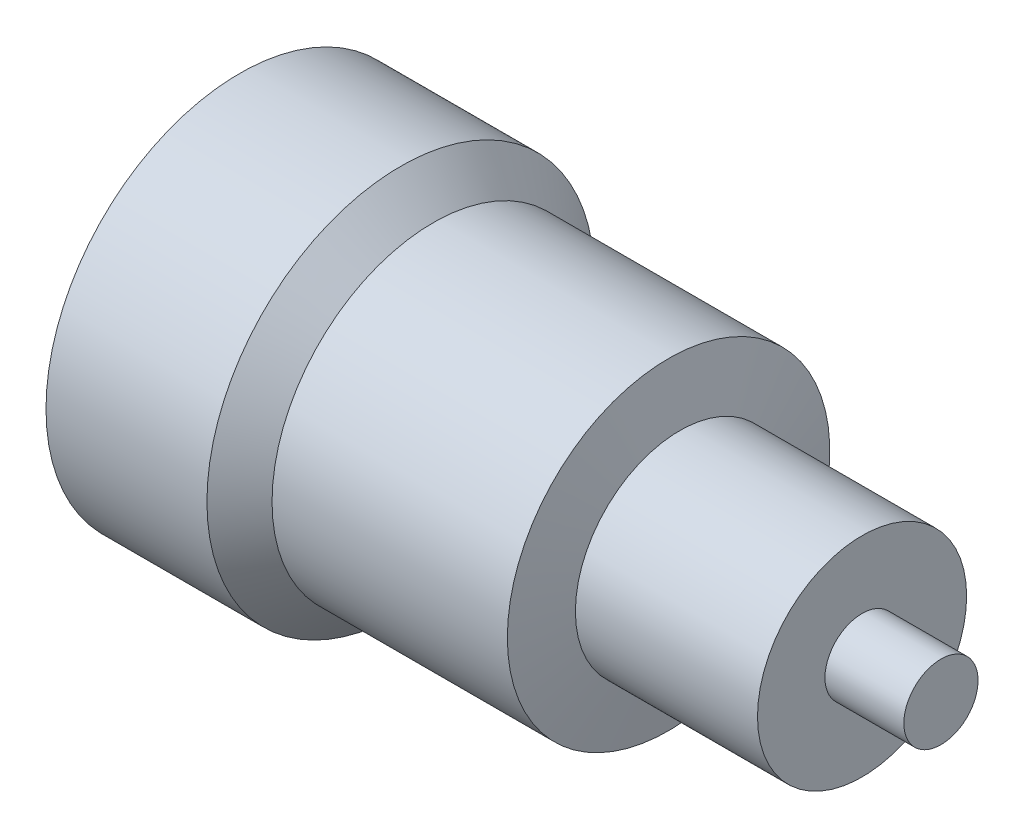
from build123d import *


with BuildPart() as part:
    # 草圖1 → 旋轉1 (revolve)
    with BuildSketch(Plane.XY, mode=Mode.PRIVATE) as revolve_1_sk:
        Polygon((19.961538462, 24.038461538), (0, 24.038461538), (0, 20), (19.498987945, 20), (34.66058388, 0), (62.989296512, 0), (86.972642067, 0), (86.972642067, 4.604372638), (77.187288704, 4.604372638), (77.187288704, 12.971100252), (54.598372627, 12.971100252), (53.187288704, 20), (24, 20), align=None)
    revolve(revolve_1_sk.sketch.rotate(Axis((0, 0, 0), (1, 0, 0)), 90), axis=Axis((0, 0, 0), (1, 0, 0)))


solid = part.part
